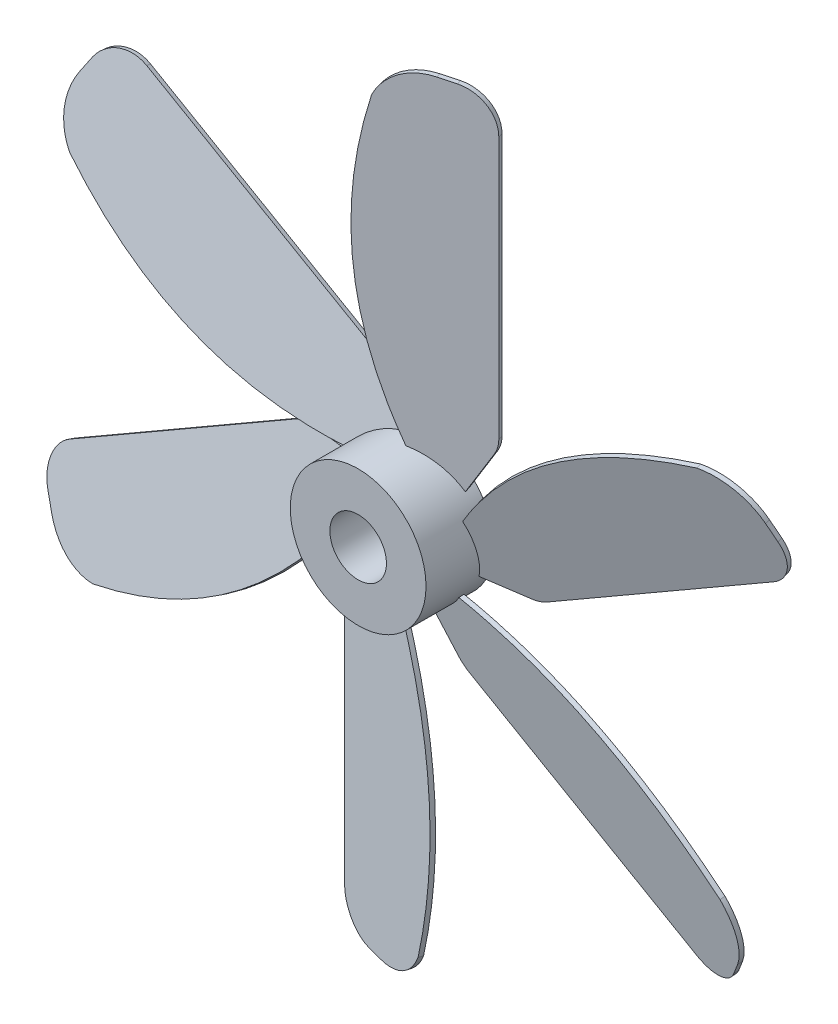
from build123d import *

# Parameters (mm, degrees)
SKETCH_2_R               = 6
SKETCH_2_R_2             = 2.5
EXTRUDE_1_DEPTH          = 4
EXTRUDE_2_DEPTH          = 0.2
SKETCH_2_5_R             = 6
SKETCH_2_5_R_2           = 2.5
EXTRUDE_6_DEPTH          = 2
PATTERN_CIRCULAR_1_COUNT = 6


with BuildPart() as part:
    # 草图2 → 凸台-拉伸1 (new body)
    with BuildSketch(Plane.XY):
        Circle(SKETCH_2_R)
        Circle(SKETCH_2_R_2, mode=Mode.SUBTRACT)
    extrude(amount=EXTRUDE_1_DEPTH)

    # 草图6 → 凸台-拉伸2 (add, symmetric)
    with BuildSketch(Plane(origin=(0, 0, 0), x_dir=(0.9659258262890681, 0, -0.2588190451025218), z_dir=(0.2588190451025218, 0, 0.9659258262890681))):
        with BuildLine():
            Line((4, 2.970800909), (6.665063509, 7.586826313))
            ThreePointArc((6.665063509, 7.586826313), (6.914814566, 8.1897787), (7, 8.836826313))
            Line((7, 8.836826313), (7, 32))
            ThreePointArc((7, 32), (6.121320344, 34.121320344), (4, 35))
            Line((4, 35), (2.519223828, 35))
            ThreePointArc((2.519223828, 35), (-0.267681994, 34.186020016), (-2.178368771, 32))
            add(Edge.make_bspline(
                [(-2.178368771, 32), (-6.131576328, 18.074358524), (0.381779744, 5.817884597)],
                knots=[0, 0, 0, 1, 1, 1], degree=2))
            add(Edge.make_bspline(
                [(4, 2.970800909), (2.776948837, 5.192610395), (0.381779744, 5.817884597)],
                knots=[5.230377445, 5.230377445, 5.230377445, 6.036173694, 6.036173694, 6.036173694], degree=2, weights=[1, 0.919928545, 1]))
        make_face()
    extrude_2 = extrude(amount=EXTRUDE_2_DEPTH, both=True)

    # 草图2<5> → 凸台-拉伸6 (add, symmetric)
    with BuildSketch(Plane.XY):
        Circle(SKETCH_2_5_R)
        Circle(SKETCH_2_5_R_2, mode=Mode.SUBTRACT)
    extrude(amount=EXTRUDE_6_DEPTH, both=True)

    # 阵列(圆周)1: 凸台-拉伸2 ×6 about axis
    pattern_circular_1_axis = Axis((0, 0, 4), (0, 0, -1))
    for i in range(1, PATTERN_CIRCULAR_1_COUNT):
        add(extrude_2.rotate(pattern_circular_1_axis, i * 360 / PATTERN_CIRCULAR_1_COUNT))


solid = part.part
